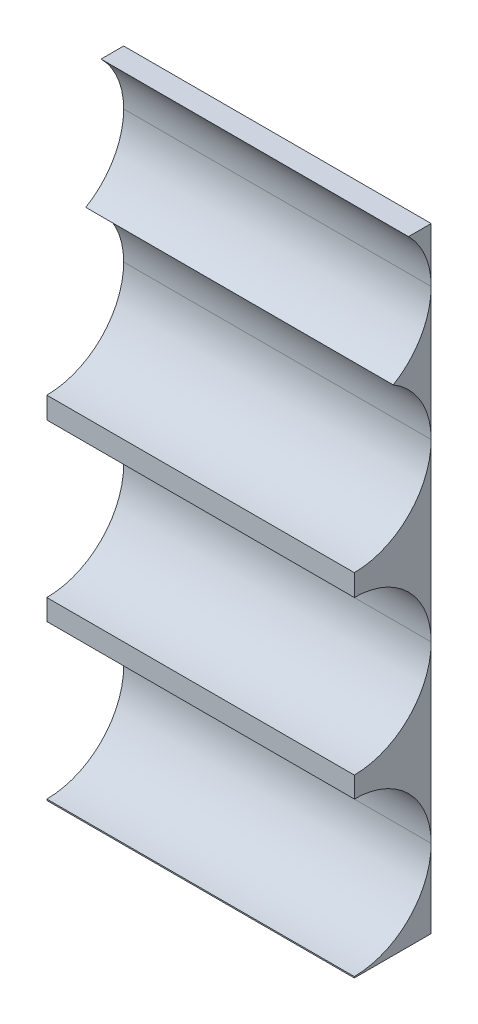
from build123d import *

# Parameters (mm, degrees)
SKETCH_1_W          = 8
SKETCH_1_H          = 16
EXTRUDE_1_DEPTH     = 2
CUT_EXTRUDE_1_DEPTH = 8


with BuildPart() as part:
    # 草图1 → 凸台-拉伸1 (new body)
    with BuildSketch(Plane.XY):
        with Locations((4, 8)):
            Rectangle(SKETCH_1_W, SKETCH_1_H)
    extrude(amount=EXTRUDE_1_DEPTH)

    # 草图3 → 切除-拉伸1 (cut)
    with BuildSketch(Plane.ZY):
        with BuildLine():
            Line((0.58928448, 16), (2, 16))
            Line((2, 16), (2, 9.133143651))
            ThreePointArc((2, 9.133143651), (0.070083762, 10.608335769), (0.987164748, 12.857720338))
            ThreePointArc((0.987164748, 12.857720338), (0.01584276, 14.331059995), (0.58928448, 16))
        make_face()
        with BuildLine():
            Line((2, 4.032540219), (2, 0.032540219))
            ThreePointArc((2, 0.032540219), (0, 2.032540219), (2, 4.032540219))
        make_face()
        with BuildLine():
            Line((2, 8.572993402), (2, 4.572993402))
            ThreePointArc((2, 4.572993402), (0, 6.572993402), (2, 8.572993402))
        make_face()
    extrude(amount=-CUT_EXTRUDE_1_DEPTH, mode=Mode.SUBTRACT)


with BuildPart() as cut_extrude_1_piece_1:
    # of the separate pieces the step leaves, piece 1, a body of its own (cut_extrude_1_pieces)
    add(part.part.solids().sort_by_distance((0, 8.572993402, 2))[0])


with BuildPart() as cut_extrude_1_piece_2:
    # of the separate pieces the step leaves, piece 2, a body of its own (cut_extrude_1_pieces)
    add(part.part.solids().sort_by_distance((0, 4.032540219, 2))[0])


with BuildPart() as cut_extrude_1_piece_3:
    # of the separate pieces the step leaves, piece 3, a body of its own (cut_extrude_1_pieces)
    add(part.part.solids().sort_by_distance((0, 12.857720338, 0.987164748))[0])


with BuildPart() as cut_extrude_1_piece_4:
    # of the separate pieces the step leaves, piece 4, a body of its own (cut_extrude_1_pieces)
    add(part.part.solids().sort_by_distance((0, 0, 0))[0])


with BuildPart() as cut_extrude_1_piece_5:
    # of the separate pieces the step leaves, piece 5, a body of its own (cut_extrude_1_pieces)
    add(part.part.solids().sort_by_distance((0, 16, 0))[0])


solid = Compound([cut_extrude_1_piece_1.part, cut_extrude_1_piece_2.part, cut_extrude_1_piece_3.part, cut_extrude_1_piece_4.part, cut_extrude_1_piece_5.part])
